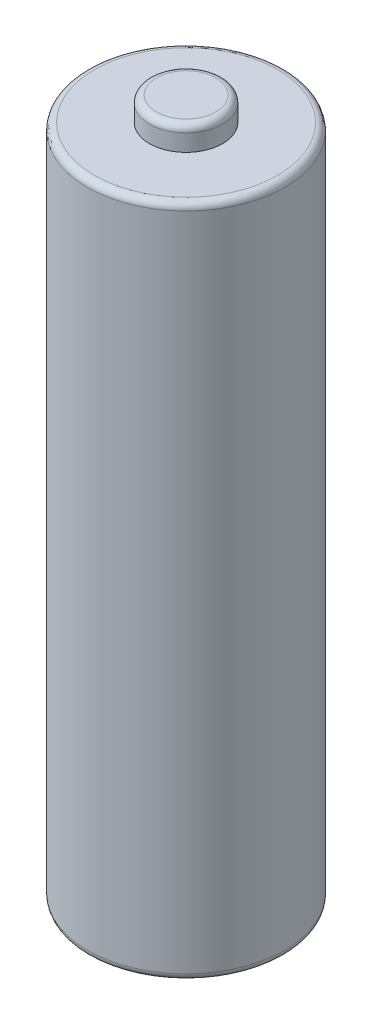
from build123d import *

# Parameters (mm, degrees)
SKETCH1_R           = 7.05
BOSS_EXTRUDE2_DEPTH = 48.25
SKETCH2_R           = 2.62
BOSS_EXTRUDE3_DEPTH = 1.71
FILLET1_R           = 0.5


with BuildPart() as part:
    # Sketch1 → Boss-Extrude2 (new body)
    with BuildSketch(Plane(origin=(0, 0, 0), x_dir=(1, 0, 0), z_dir=(0, 1, 0))):
        with Locations(Location((0, 0, 0), (0, 0, 270))):
            Circle(SKETCH1_R)
    extrude(amount=BOSS_EXTRUDE2_DEPTH)

    # Sketch2 → Boss-Extrude3 (add)
    with BuildSketch(Plane(origin=(0, 48.25, 0), x_dir=(1, 0, 0), z_dir=(0, 1, 0))):
        with Locations(Location((0, 0, 0), (0, 0, 270))):
            Circle(SKETCH2_R)
    extrude(amount=BOSS_EXTRUDE3_DEPTH)

    # Fillet1
    fillet1_edges = [part.edges().sort_by_distance(p)[0] for p in [
        (0, 0, -7.05),
        (0, 48.25, -7.05),
        (0, 49.96, -2.62),
    ]]
    fillet(fillet1_edges, radius=FILLET1_R)


solid = part.part
